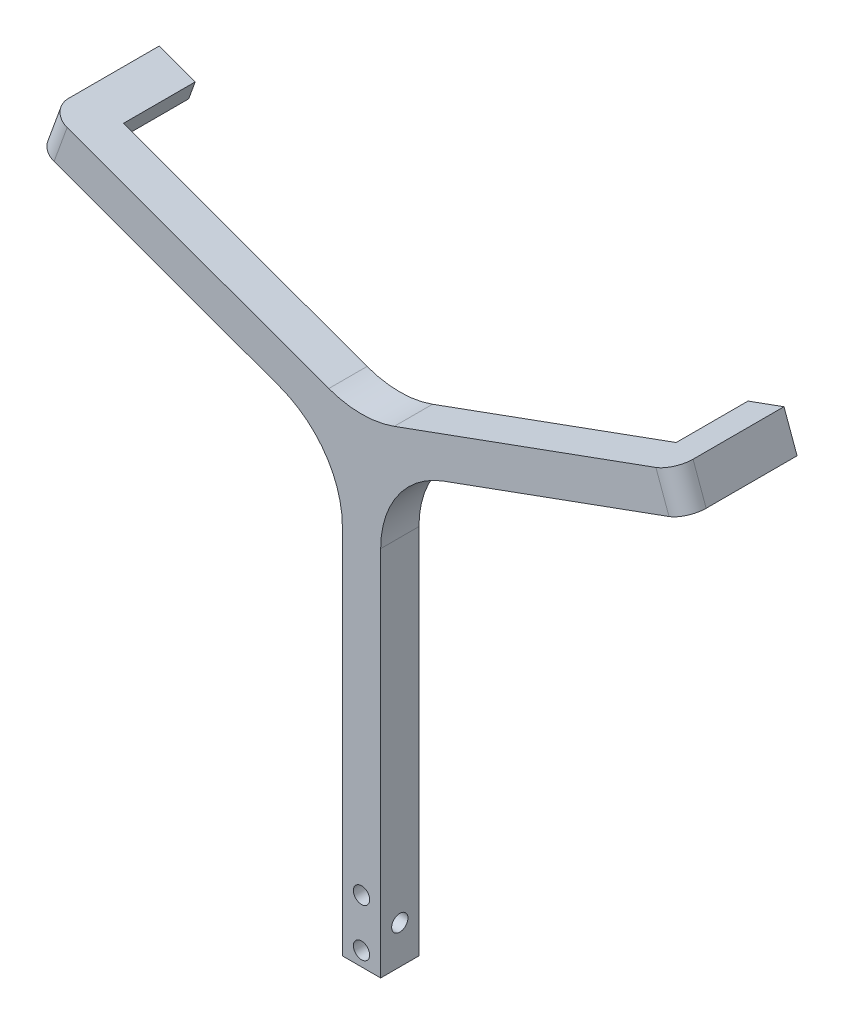
from build123d import *

# Parameters (mm, degrees)
BOSS_EXTRU_1_DEPTH      = 8
BOSS_EXTRU_2_DEPTH      = 15
CONG_1_R                = 20
CONG_2_R                = 4
ESQUISSE3_R             = 7.5
BOSS_EXTRU_3_DEPTH      = 8
ENL_V_MAT_EXTRU_1_DEPTH = 172.56339936
ESQUISSE5_W             = 8
ESQUISSE5_H             = 15
ENL_V_MAT_EXTRU_2_DEPTH = 7.5
ESQUISSE6_W             = 8
ESQUISSE6_H             = 15
ENL_V_MAT_EXTRU_3_DEPTH = 32.5
ESQUISSE7_R             = 1.5
ENL_V_MAT_EXTRU_4_DEPTH = 8
D_GAGEMENT_M31_D        = 3.4
D_GAGEMENT_M31_DEPTH    = 10
D_GAGEMENT_M31_TIP      = 1.021463052
ESQUISSE10_R            = 1.5
ENL_V_MAT_EXTRU_5_DEPTH = 8
D_GAGEMENT_M32_D        = 3.4
D_GAGEMENT_M32_DEPTH    = 10
D_GAGEMENT_M32_TIP      = 1.021463052


with BuildPart() as part:
    # Esquisse1 → Boss.-Extru.1 (new body)
    with BuildSketch(Plane.XY):
        Polygon((64, 0), (64, 124.188364041), (0, 147.482459034), (2.736161147, 155), (68, 131.245905283), (133.263838853, 155), (136, 147.482459034), (72, 124.188364041), (72, 0), align=None)
    extrude(amount=BOSS_EXTRU_1_DEPTH)

    # Esquisse2 → Boss.-Extru.2 (add)
    with BuildSketch(Plane(origin=(0, 0, 0), x_dir=(-1, 0, 0), z_dir=(0, 0, -1))):
        Polygon((-132.241229517, 146.11437846), (-136, 147.482459034), (-133.263838853, 155), (-125.746297887, 152.263838853), (-127.11437846, 148.50506837), align=None)
        Polygon((0, 147.482459034), (-3.758770483, 146.11437846), (-8.88562154, 148.50506837), (-10.253702113, 152.263838853), (-2.736161147, 155), align=None)
    extrude(amount=BOSS_EXTRU_2_DEPTH)

    # Congé1
    cong_1_edges = [part.edges().sort_by_distance(p)[0] for p in [
        (64, 124.188364041, 4),
        (68, 131.245905283, 4),
        (72, 124.188364041, 4),
    ]]
    fillet(cong_1_edges, radius=CONG_1_R)

    # Congé2
    cong_2_edges = [part.edges().sort_by_distance(p)[0] for p in [
        (134.631919427, 151.241229517, 8),
        (1.368080573, 151.241229517, 8),
    ]]
    fillet(cong_2_edges, radius=CONG_2_R)

    # Esquisse3 → Boss.-Extru.3 (add)
    with BuildSketch(Plane.ZY.offset(-64)):
        with Locations((4, 0)):
            Circle(ESQUISSE3_R)
    extrude(amount=-BOSS_EXTRU_3_DEPTH)

    # Esquisse4 → Enlèv. mat.-Extru.1 (cut, through all)
    with BuildSketch(Plane.ZY.offset(-64)):
        with BuildLine():
            Line((2.25357508, 2.8), (5.74642492, 2.8))
            ThreePointArc((5.74642492, 2.8), (4, -3.3), (2.25357508, 2.8))
        make_face()
    extrude(amount=-ENL_V_MAT_EXTRU_1_DEPTH, mode=Mode.SUBTRACT)

    # Esquisse5 → Enlèv. mat.-Extru.2 (cut)
    with BuildSketch(Plane(origin=(0, 0, 0), x_dir=(1, 0, 0), z_dir=(0, 1, 0))):
        with Locations((68, -4)):
            Rectangle(ESQUISSE5_W, ESQUISSE5_H)
    extrude(amount=-ENL_V_MAT_EXTRU_2_DEPTH, mode=Mode.SUBTRACT)

    # Esquisse6 → Enlèv. mat.-Extru.3 (cut)
    with BuildSketch(Plane.XZ):
        with Locations((68, 4)):
            Rectangle(ESQUISSE6_W, ESQUISSE6_H)
    extrude(amount=-ENL_V_MAT_EXTRU_3_DEPTH, mode=Mode.SUBTRACT)

    # Esquisse7 → Enlèv. mat.-Extru.4 (cut)
    with BuildSketch(Plane.ZY.offset(-64)):
        with Locations(Location((4, 40.5, 0), (0, 0, 270))):
            Circle(ESQUISSE7_R)
    extrude(amount=-ENL_V_MAT_EXTRU_4_DEPTH, mode=Mode.SUBTRACT)

    # Dégagement M31
    with Locations(Plane.ZY.offset(-64)):
        with Locations((4, 40.5)):
            Hole(D_GAGEMENT_M31_D / 2, depth=D_GAGEMENT_M31_DEPTH)
            with Locations((0, 0, -(D_GAGEMENT_M31_DEPTH + D_GAGEMENT_M31_TIP / 2))):  # 118° drill point
                Cone(0, D_GAGEMENT_M31_D / 2, D_GAGEMENT_M31_TIP, mode=Mode.SUBTRACT)

    # Esquisse10 → Enlèv. mat.-Extru.5 (cut)
    with BuildSketch(Plane.XY.offset(8)):
        with Locations((68, 35.5)):
            Circle(ESQUISSE10_R)
        with Locations((68, 45.5)):
            Circle(ESQUISSE10_R)
    extrude(amount=-ENL_V_MAT_EXTRU_5_DEPTH, mode=Mode.SUBTRACT)

    # Dégagement M32
    with Locations(Plane(origin=(0, 0, 0), x_dir=(-1, 0, 0), z_dir=(0, 0, -1))):
        with Locations((-68, 45.5), (-68, 35.5)):
            Hole(D_GAGEMENT_M32_D / 2, depth=D_GAGEMENT_M32_DEPTH)
            with Locations((0, 0, -(D_GAGEMENT_M32_DEPTH + D_GAGEMENT_M32_TIP / 2))):  # 118° drill point
                Cone(0, D_GAGEMENT_M32_D / 2, D_GAGEMENT_M32_TIP, mode=Mode.SUBTRACT)


solid = part.part
